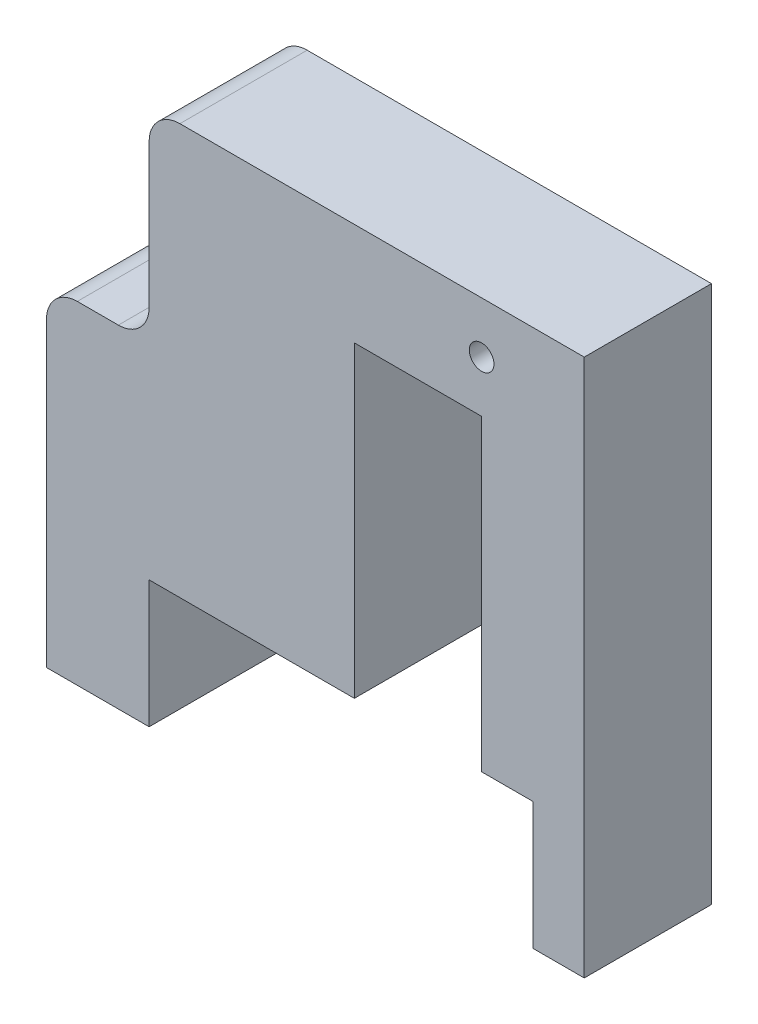
from build123d import *

# Parameters (mm, degrees)
MODEL_R             = 1.2
BOSS_EXTRUDE1_DEPTH = 12.4


with BuildPart() as part:
    # Model → Boss-Extrude1 (new body)
    with BuildSketch(Plane.XY):
        with BuildLine():
            Line((47.4, 0), (52.4, 0))
            Line((52.4, 0), (52.4, 52.4))
            Line((52.4, 52.4), (13, 52.4))
            ThreePointArc((13, 52.4), (10.878679656, 51.521320344), (10, 49.4))
            Line((10, 49.4), (10, 35.4))
            ThreePointArc((10, 35.4), (9.121320344, 33.278679656), (7, 32.4))
            Line((7, 32.4), (3, 32.4))
            ThreePointArc((3, 32.4), (0.878679656, 31.521320344), (0, 29.4))
            Line((0, 29.4), (0, 0))
            Line((0, 0), (10, 0))
            Line((10, 0), (10, 12.4))
            Line((10, 12.4), (30, 12.4))
            Line((30, 12.4), (30, 42.4))
            Line((30, 42.4), (42.4, 42.4))
            Line((42.4, 42.4), (42.4, 12.4))
            Line((42.4, 12.4), (47.4, 12.4))
            Line((47.4, 12.4), (47.4, 0))
        make_face()
        with Locations(Location((42.4, 47.4, 0), (0, 0, 180))):
            Circle(MODEL_R, mode=Mode.SUBTRACT)
    extrude(amount=BOSS_EXTRUDE1_DEPTH)


solid = part.part
